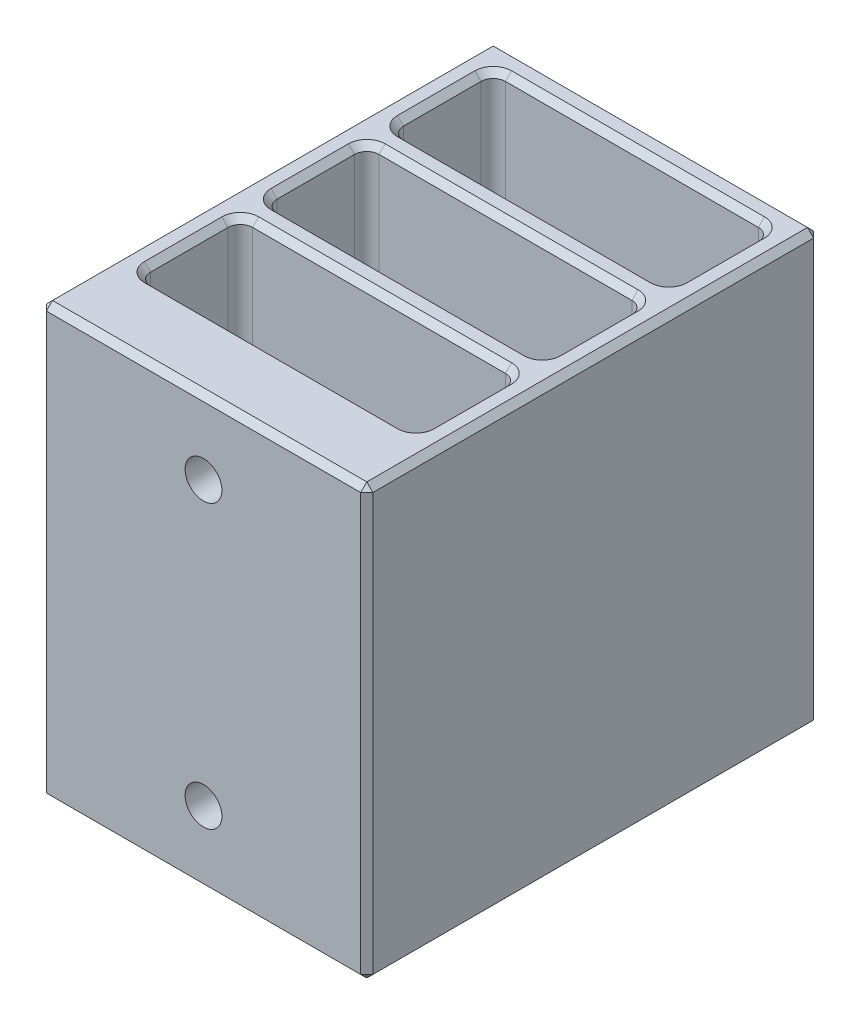
from build123d import *

# Parameters (mm, degrees)
SKETCH2_W           = 26.6
SKETCH2_H           = 36.9
SKETCH2_W_2         = 22.6
SKETCH2_H_2         = 8.3
BOSS_EXTRUDE2_DEPTH = 35
FILLET1_R           = 1
CHAMFER1_SIZE       = 0.5
CUT_EXTRUDE1_REACH  = 54.569
SKETCH3_R           = 1.5


with BuildPart() as part:
    # Sketch2 → Boss-Extrude2 (new body)
    with BuildSketch(Plane(origin=(0, 0, 0), x_dir=(1, 0, 0), z_dir=(0, 1, 0))):
        with Locations((0, -2)):
            Rectangle(SKETCH2_W, SKETCH2_H)
        with Locations((0, -10.3)):
            Rectangle(SKETCH2_W_2, SKETCH2_H_2, mode=Mode.SUBTRACT)
        Rectangle(SKETCH2_W_2, SKETCH2_H_2, mode=Mode.SUBTRACT)
        with Locations((0, 10.3)):
            Rectangle(SKETCH2_W_2, SKETCH2_H_2, mode=Mode.SUBTRACT)
    extrude(amount=BOSS_EXTRUDE2_DEPTH)

    # Fillet1
    fillet1_edges = [part.edges().sort_by_distance(p)[0] for p in [
        (-11.3, 17.5, 6.15),
        (-11.3, 17.5, 14.45),
        (11.3, 17.5, 14.45),
        (11.3, 17.5, 6.15),
        (-11.3, 17.5, -4.15),
        (-11.3, 17.5, 4.15),
        (11.3, 17.5, 4.15),
        (11.3, 17.5, -4.15),
        (-11.3, 17.5, -14.45),
        (-11.3, 17.5, -6.15),
        (11.3, 17.5, -6.15),
        (11.3, 17.5, -14.45),
    ]]
    fillet(fillet1_edges, radius=FILLET1_R)

    # Chamfer1
    chamfer1_edges = [part.edges().sort_by_distance(p)[0] for p in [
        (13.3, 35, 2),
        (0, 35, -16.45),
        (-13.3, 35, 2),
        (0, 0, -16.45),
        (13.3, 0, 2),
        (0, 0, 20.45),
        (0, 0, 14.45),
        (0, 35, 14.45),
        (11.3, 0, 10.3),
        (-13.3, 0, 2),
        (11.3, 35, 10.3),
        (-11.3, 0, 10.3),
        (-11.3, 35, 10.3),
        (0, 0, 6.15),
        (0, 35, 6.15),
        (0, 0, 4.15),
        (0, 35, 4.15),
        (11.3, 0, 0),
        (11.3, 35, 0),
        (0, 0, -4.15),
        (0, 35, -4.15),
        (-11.3, 0, 0),
        (-11.3, 35, 0),
        (11.3, 0, -10.3),
        (-13.3, 17.5, -16.45),
        (11.3, 35, -10.3),
        (13.3, 17.5, -16.45),
        (13.3, 17.5, 20.45),
        (0, 0, -14.45),
        (0, 35, -14.45),
        (-13.3, 17.5, 20.45),
        (0, 0, -6.15),
        (0, 35, -6.15),
        (-11.3, 0, -10.3),
        (-11.3, 35, -10.3),
        (11.007106781, 0, 14.157106781),
        (11.007106781, 35, 14.157106781),
        (-11.007106781, 0, 14.157106781),
        (-11.007106781, 35, 14.157106781),
        (0, 35, 20.45),
        (-11.007106781, 0, 6.442893219),
        (-11.007106781, 35, 6.442893219),
        (11.007106781, 0, 6.442893219),
        (11.007106781, 35, 6.442893219),
        (11.007106781, 0, 3.857106781),
        (11.007106781, 35, 3.857106781),
        (11.007106781, 0, -3.857106781),
        (11.007106781, 35, -3.857106781),
        (-11.007106781, 0, -3.857106781),
        (-11.007106781, 35, -3.857106781),
        (-11.007106781, 0, 3.857106781),
        (-11.007106781, 35, 3.857106781),
        (11.007106781, 0, -14.157106781),
        (11.007106781, 35, -14.157106781),
        (11.007106781, 0, -6.442893219),
        (11.007106781, 35, -6.442893219),
        (-11.007106781, 0, -14.157106781),
        (-11.007106781, 35, -14.157106781),
        (-11.007106781, 0, -6.442893219),
        (-11.007106781, 35, -6.442893219),
    ]]
    chamfer(chamfer1_edges, length=CHAMFER1_SIZE)

    # Sketch3 → Cut-Extrude1 (cut, up to next)
    with BuildSketch(Plane.XY.offset(20.45), mode=Mode.PRIVATE) as cut_extrude1_sk1:
        with Locations((0, 29)):
            Circle(SKETCH3_R)
    cut_extrude1_tool1 = extrude(cut_extrude1_sk1.sketch, amount=-CUT_EXTRUDE1_REACH, mode=Mode.PRIVATE) & part.part
    # Sketch3 → Cut-Extrude1 (cut, up to next)
    with BuildSketch(Plane.XY.offset(20.45), mode=Mode.PRIVATE) as cut_extrude1_sk2:
        with Locations((0, 6)):
            Circle(SKETCH3_R)
    cut_extrude1_tool2 = extrude(cut_extrude1_sk2.sketch, amount=-CUT_EXTRUDE1_REACH, mode=Mode.PRIVATE) & part.part
    add(cut_extrude1_tool1.solids().sort_by_distance((0, 29, 20.45))[0], mode=Mode.SUBTRACT)
    add(cut_extrude1_tool2.solids().sort_by_distance((0, 6, 20.45))[0], mode=Mode.SUBTRACT)


solid = part.part
